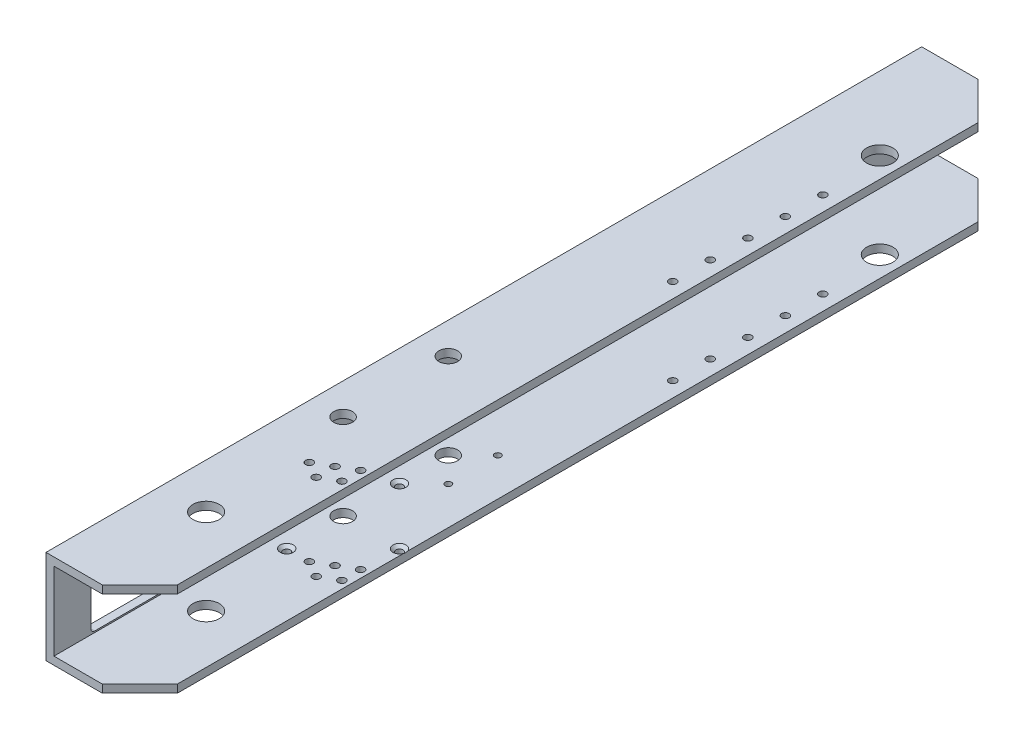
from build123d import *

# Parameters (mm, degrees)
BOSS_EXTRUDE1_DEPTH                                 = 700
CUT_EXTRUDE1_DEPTH                                  = 706.00443261
CHAMFER1_SIZE                                       = 30
SKETCH4_R                                           = 10.5
CUT_EXTRUDE2_DEPTH                                  = 708.990112925
SKETCH5_R                                           = 7.5
CUT_EXTRUDE3_DEPTH                                  = 708.990112925
CHAMFER2_SIZE                                       = 3
FILLET1_R                                           = 3
SKETCH6_R                                           = 3
TENSIONER_HOLES_DEPTH                               = 708.990112925
CSK_FOR_M5_COUNTERSUNK_FLAT_HEAD_SCREW1_D           = 5.8
CSK_FOR_M5_COUNTERSUNK_FLAT_HEAD_SCREW1_DEPTH       = 12
CSK_FOR_M5_COUNTERSUNK_FLAT_HEAD_SCREW1_CSINK_D     = 10.4
CSK_FOR_M5_COUNTERSUNK_FLAT_HEAD_SCREW1_CSINK_ANGLE = 90
CSK_FOR_M5_COUNTERSUNK_FLAT_HEAD_SCREW1_TIP         = 1.742495795
SKETCH11_R                                          = 3
CUT_EXTRUDE4_DEPTH                                  = 10
SKETCH13_R                                          = 2.55
CUT_EXTRUDE5_DEPTH                                  = 10


with BuildPart() as part:
    # Sketch1 → Boss-Extrude1 (new body)
    with BuildSketch(Plane.XY):
        Polygon((0, -37.5), (0, 37.5), (75, 37.5), (75, 31.15), (6.35, 31.15), (6.35, -31.15), (75, -31.15), (75, -37.5), align=None)
    extrude(amount=BOSS_EXTRUDE1_DEPTH)

    # Sketch3 → Cut-Extrude1 (cut, through all)
    with BuildSketch(Plane.ZY):
        Polygon((670.5, -30), (545.5, -30), (395.5, -30), (395.5, -16.85), (355, -16.85), (355, 4.15), (460, 4.15), (545.5, 4.15), (545.5, 30), (670.5, 30), align=None)
    extrude(amount=-CUT_EXTRUDE1_DEPTH, mode=Mode.SUBTRACT)

    # Chamfer1
    chamfer1_edges = [part.edges().sort_by_distance(p)[0] for p in [
        (75, 34.325, 700),
        (75, -34.325, 700),
        (75, -34.325, 0),
        (75, 34.325, 0),
    ]]
    chamfer(chamfer1_edges, length=CHAMFER1_SIZE)

    # Sketch4 → Cut-Extrude2 (cut, through all)
    with BuildSketch(Plane(origin=(0, 37.5, 0), x_dir=(1, 0, 0), z_dir=(0, 1, 0))):
        with Locations((36, -608)):
            Circle(SKETCH4_R)
        with Locations((58.5, -92)):
            Circle(SKETCH4_R)
    extrude(amount=-CUT_EXTRUDE2_DEPTH, mode=Mode.SUBTRACT)

    # Sketch5 → Cut-Extrude3 (cut, through all)
    with BuildSketch(Plane.XZ.offset(37.5)):
        with Locations((25, 487.498060398)):
            Circle(SKETCH5_R)
        with Locations((24.951834767, 403.39807419)):
            Circle(SKETCH5_R)
    extrude(amount=-CUT_EXTRUDE3_DEPTH, mode=Mode.SUBTRACT)

    # Chamfer2
    chamfer2_edges = [part.edges().sort_by_distance(p)[0] for p in [
        (6.35, 17.075, 545.5),
        (6.35, -23.425, 395.5),
        (6.35, -6.35, 355),
    ]]
    chamfer(chamfer2_edges, length=CHAMFER2_SIZE)

    # Fillet1
    fillet1_edges = [part.edges().sort_by_distance(p)[0] for p in [
        (1.675, -16.85, 355),
        (1.675, 4.15, 355),
        (3.175, 30, 670.5),
        (3.175, -30, 670.5),
        (1.675, 30, 545.5),
        (1.675, -30, 395.5),
    ]]
    fillet(fillet1_edges, radius=FILLET1_R)

    # Sketch6 → tensioner holes (cut, through all)
    with BuildSketch(Plane(origin=(0, 37.5, 0), x_dir=(1, 0, 0), z_dir=(0, 1, 0))):
        with Locations((69, -517.498060398)):
            Circle(SKETCH6_R)
        with Locations((69, -532.498060398)):
            Circle(SKETCH6_R)
        with Locations((56.009618943, -524.998060398)):
            Circle(SKETCH6_R)
        with Locations((56.009618943, -539.998060398)):
            Circle(SKETCH6_R)
        with Locations((63, -262)):
            Circle(SKETCH6_R)
        with Locations((63, -232)):
            Circle(SKETCH6_R)
        with Locations((63, -202)):
            Circle(SKETCH6_R)
        with Locations((63, -172)):
            Circle(SKETCH6_R)
        with Locations((63, -142)):
            Circle(SKETCH6_R)
        with Locations((43.019237886, -532.498060398)):
            Circle(SKETCH6_R)
    extrude(amount=-TENSIONER_HOLES_DEPTH, mode=Mode.SUBTRACT)

    # CSK for M5 Countersunk Flat Head Screw1
    with Locations(Plane(origin=(0, -31.15, 0), x_dir=(-1, 0, 0), z_dir=(0, 1, 0))):
        with Locations((-25, 532.573060398), (-25, 442.423060398), (-70.075, 487.498060398)):
            CounterSinkHole(CSK_FOR_M5_COUNTERSUNK_FLAT_HEAD_SCREW1_D / 2, CSK_FOR_M5_COUNTERSUNK_FLAT_HEAD_SCREW1_CSINK_D / 2, depth=CSK_FOR_M5_COUNTERSUNK_FLAT_HEAD_SCREW1_DEPTH, counter_sink_angle=CSK_FOR_M5_COUNTERSUNK_FLAT_HEAD_SCREW1_CSINK_ANGLE)
            with Locations((0, 0, -(CSK_FOR_M5_COUNTERSUNK_FLAT_HEAD_SCREW1_DEPTH + CSK_FOR_M5_COUNTERSUNK_FLAT_HEAD_SCREW1_TIP / 2))):  # 118° drill point
                Cone(0, CSK_FOR_M5_COUNTERSUNK_FLAT_HEAD_SCREW1_D / 2, CSK_FOR_M5_COUNTERSUNK_FLAT_HEAD_SCREW1_TIP, mode=Mode.SUBTRACT)

    # Sketch11 → Cut-Extrude4 (cut)
    with BuildSketch(Plane.ZY):
        with Locations((350, -24)):
            Circle(SKETCH11_R)
        with Locations((13.5, -24)):
            Circle(SKETCH11_R)
        with Locations((181.75, -24)):
            Circle(SKETCH11_R)
    extrude(amount=-CUT_EXTRUDE4_DEPTH, mode=Mode.SUBTRACT)

    # Sketch13 → Cut-Extrude5 (cut)
    with BuildSketch(Plane.XZ.offset(37.5)):
        with Locations((5.152844894, 423.197064064)):
            Circle(SKETCH13_R)
        with Locations((5.152844894, 383.599084317)):
            Circle(SKETCH13_R)
        with Locations((44.75082464, 383.599084317)):
            Circle(SKETCH13_R)
        with Locations((44.75082464, 423.197064064)):
            Circle(SKETCH13_R)
    extrude(amount=-CUT_EXTRUDE5_DEPTH, mode=Mode.SUBTRACT)


solid = part.part
